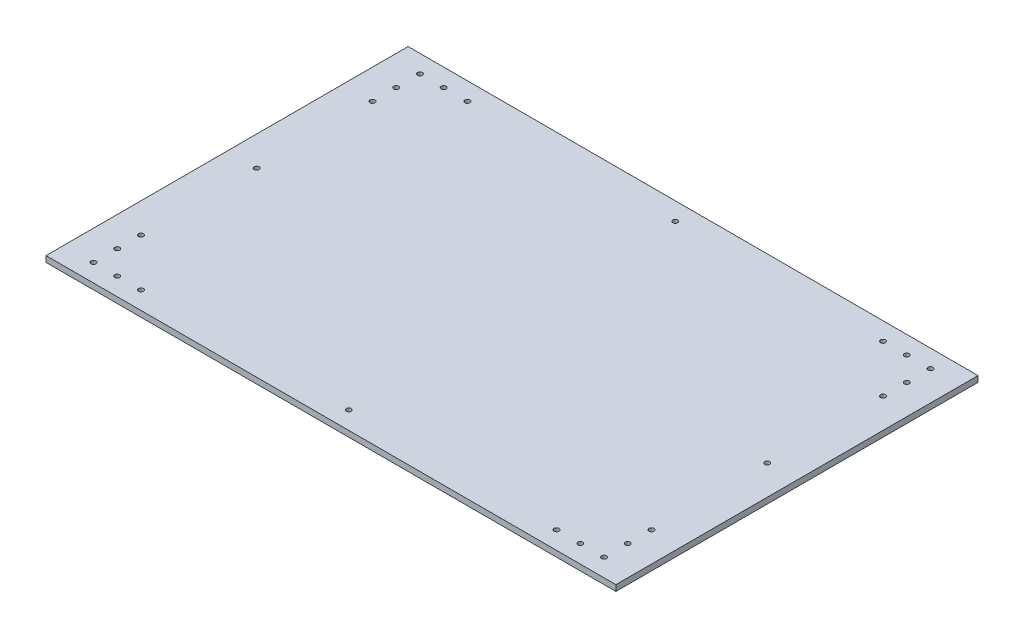
from build123d import *

# Parameters (mm, degrees)
SKETCH1_W                  = 609.6
SKETCH1_H                  = 609.6
BOSS_EXTRUDE1_DEPTH        = 6.35
SKETCH2_W                  = 609.6
SKETCH2_H                  = 222.25
BOSS_EXTRUDE2_DEPTH        = 25.4
F_5_3_5_3_DIAMETER_HOLE1_D = 5.3
CUT_EXTRUDE1_REACH         = 864.689
SKETCH6_W                  = 609.6
SKETCH6_H                  = 222.25


with BuildPart() as part:
    # Sketch1 → Boss-Extrude1 (new body)
    with BuildSketch(Plane(origin=(0, 0, 0), x_dir=(1, 0, 0), z_dir=(0, 1, 0))):
        with Locations((304.8, 304.8)):
            Rectangle(SKETCH1_W, SKETCH1_H)
    extrude(amount=BOSS_EXTRUDE1_DEPTH)

    # Sketch2 → Boss-Extrude2 (add)
    with BuildSketch(Plane(origin=(0, 6.35, 0), x_dir=(1, 0, 0), z_dir=(0, 1, 0))):
        with Locations((304.8, 498.475)):
            Rectangle(SKETCH2_W, SKETCH2_H)
    extrude(amount=BOSS_EXTRUDE2_DEPTH)

    # Ø5.3 (5.3) Diameter Hole1 (through all)
    with Locations(Plane(origin=(0, 6.35, 0), x_dir=(1, 0, 0), z_dir=(0, 1, 0))):
        with Locations((31.75, 368.3), (57.15, 368.3), (82.55, 368.3), (31.75, 342.9), (31.75, 317.5), (31.75, 69.85), (31.75, 44.45), (31.75, 19.05), (57.15, 19.05), (82.55, 19.05), (304.8, 19.05), (31.75, 193.675), (304.8, 368.3), (577.85, 193.675), (527.05, 368.3), (552.45, 368.3), (577.85, 368.3), (577.85, 342.9), (577.85, 317.5), (577.85, 69.85), (577.85, 44.45), (577.85, 19.05), (552.45, 19.05), (527.05, 19.05)):
            Hole(F_5_3_5_3_DIAMETER_HOLE1_D / 2)

    # Sketch6 → Cut-Extrude1 (cut, up to next)
    with BuildSketch(Plane(origin=(0, 31.75, 0), x_dir=(1, 0, 0), z_dir=(0, 1, 0)), mode=Mode.PRIVATE) as cut_extrude1_sk1:
        with Locations((304.8, 498.475)):
            Rectangle(SKETCH6_W, SKETCH6_H)
    cut_extrude1_tool1 = extrude(cut_extrude1_sk1.sketch, amount=-CUT_EXTRUDE1_REACH, mode=Mode.PRIVATE) & part.part
    add(cut_extrude1_tool1.solids().sort_by_distance((304.8, 31.75, -498.475))[0], mode=Mode.SUBTRACT)


solid = part.part
